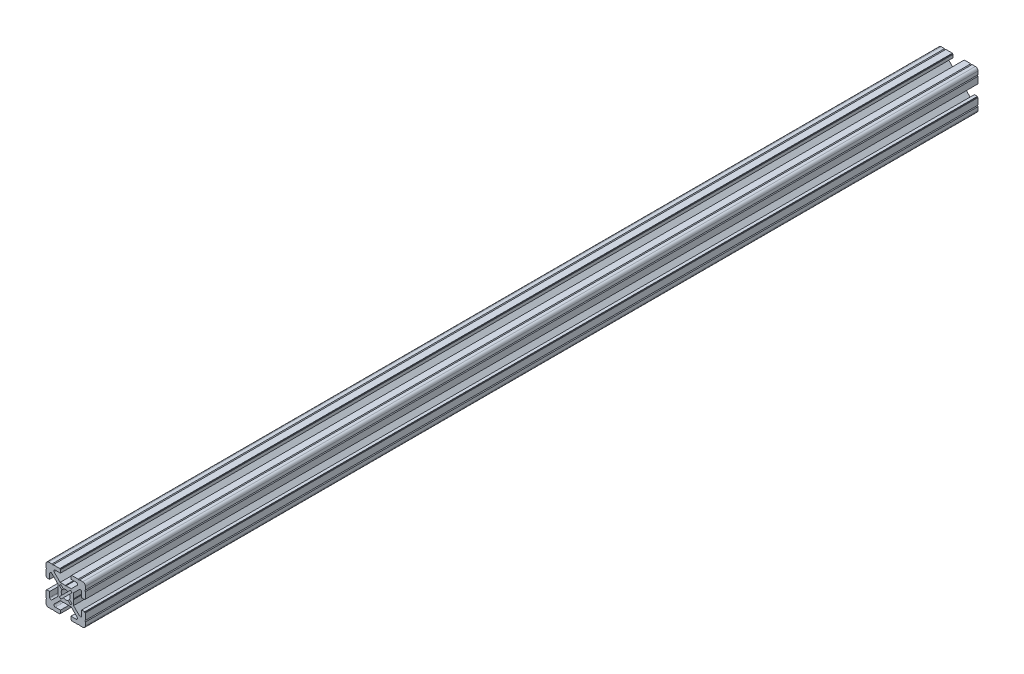
from build123d import *

# Parameters (mm, degrees)
BOSS_EXTRUDE1_DEPTH = 680


with BuildPart() as part:
    # Sketch1 → Boss-Extrude1 (new body)
    with BuildSketch(Plane.XY):
        with BuildLine():
            Line((12.999999999, 14.999999999), (10.499999999, 14.999999999))
            Line((10.499999999, 14.999999999), (9.999999999, 14.499999999))
            Line((9.999999999, 14.499999999), (9.5, 14.999999999))
            Line((9.5, 14.999999999), (4.5, 14.999999999))
            Line((4.5, 14.999999999), (4.5, 14.5))
            Line((4.5, 14.5), (4, 14.5))
            Line((4, 14.5), (4, 12.200000005))
            Line((4, 12.200000005), (7.999999994, 12.200000005))
            ThreePointArc((7.999999994, 12.200000005), (8.923879532, 11.582683434), (8.707106779, 10.492893215))
            Line((8.707106779, 10.492893215), (4.214213564, 6))
            Line((4.214213564, 6), (0.312520901, 6))
            Line((0.312520901, 6), (0, 5.7))
            Line((0, 5.7), (-0.312520903, 6))
            Line((-0.312520903, 6), (-4.214213564, 6))
            Line((-4.214213564, 6), (-8.70710678, 10.492893215))
            ThreePointArc((-8.70710678, 10.492893215), (-8.923879532, 11.582683434), (-7.999999995, 12.200000005))
            Line((-7.999999995, 12.200000005), (-4, 12.200000005))
            Line((-4, 12.200000005), (-4, 14.5))
            Line((-4, 14.5), (-4.5, 14.5))
            Line((-4.5, 14.5), (-4.5, 14.999999999))
            Line((-4.5, 14.999999999), (-9.500000003, 14.999999999))
            Line((-9.500000003, 14.999999999), (-10.000000002, 14.499999999))
            Line((-10.000000002, 14.499999999), (-10.500000001, 14.999999999))
            Line((-10.500000001, 14.999999999), (-13, 14.999999999))
            ThreePointArc((-13, 14.999999999), (-14.414213562, 14.414213561), (-15, 12.999999999))
            Line((-15, 12.999999999), (-15, 10.5))
            Line((-15, 10.5), (-14.500000001, 10.000000001))
            Line((-14.500000001, 10.000000001), (-15, 9.500000001))
            Line((-15, 9.500000001), (-15, 4.5))
            Line((-15, 4.5), (-14.5, 4.5))
            Line((-14.5, 4.5), (-14.5, 4))
            Line((-14.5, 4), (-12.200000005, 4))
            Line((-12.200000005, 4), (-12.200000005, 7.999999994))
            ThreePointArc((-12.200000005, 7.999999994), (-11.582683434, 8.923879532), (-10.492893215, 8.707106779))
            Line((-10.492893215, 8.707106779), (-6, 4.214213564))
            Line((-6, 4.214213564), (-6, 0.312520901))
            Line((-6, 0.312520901), (-5.7, 0))
            Line((-5.7, 0), (-6, -0.312520903))
            Line((-6, -0.312520903), (-6, -4.214213564))
            Line((-6, -4.214213564), (-10.492893215, -8.70710678))
            ThreePointArc((-10.492893215, -8.70710678), (-11.582683434, -8.923879532), (-12.200000005, -7.999999995))
            Line((-12.200000005, -7.999999995), (-12.200000005, -4))
            Line((-12.200000005, -4), (-14.5, -4))
            Line((-14.5, -4), (-14.5, -4.5))
            Line((-14.5, -4.5), (-15, -4.5))
            Line((-15, -4.5), (-15, -9.500000001))
            Line((-15, -9.500000001), (-14.500000001, -10.000000001))
            Line((-14.500000001, -10.000000001), (-15, -10.5))
            Line((-15, -10.5), (-15, -13))
            ThreePointArc((-15, -13), (-14.414213562, -14.414213562), (-13, -15))
            Line((-13, -15), (-10.489897949, -15))
            Line((-10.489897949, -15), (-9.989897949, -14.5))
            Line((-9.989897949, -14.5), (-9.500000001, -15))
            Line((-9.500000001, -15), (-4.5, -15))
            Line((-4.5, -15), (-4.5, -14.5))
            Line((-4.5, -14.5), (-4, -14.5))
            Line((-4, -14.5), (-4, -12.200000005))
            Line((-4, -12.200000005), (-7.999999995, -12.200000005))
            ThreePointArc((-7.999999995, -12.200000005), (-8.923879532, -11.582683434), (-8.70710678, -10.492893215))
            Line((-8.70710678, -10.492893215), (-4.214213564, -6))
            Line((-4.214213564, -6), (-0.312520901, -6))
            Line((-0.312520901, -6), (0, -5.7))
            Line((0, -5.7), (0.312520903, -6))
            Line((0.312520903, -6), (4.214213564, -6))
            Line((4.214213564, -6), (8.70710678, -10.492893215))
            ThreePointArc((8.70710678, -10.492893215), (8.923879532, -11.582683434), (7.999999995, -12.200000005))
            Line((7.999999995, -12.200000005), (4, -12.200000005))
            Line((4, -12.200000005), (4, -14.5))
            Line((4, -14.5), (4.5, -14.5))
            Line((4.5, -14.5), (4.5, -15))
            Line((4.5, -15), (9.500000001, -15))
            Line((9.500000001, -15), (10.000000001, -14.500000001))
            Line((10.000000001, -14.500000001), (10.5, -15))
            Line((10.5, -15), (12.999999999, -15))
            ThreePointArc((12.999999999, -15), (14.414213561, -14.414213562), (14.999999999, -13))
            Line((14.999999999, -13), (14.999999999, -10.500000001))
            Line((14.999999999, -10.500000001), (14.499999999, -10.000000002))
            Line((14.499999999, -10.000000002), (14.999999999, -9.500000002))
            Line((14.999999999, -9.500000002), (14.999999999, -4.5))
            Line((14.999999999, -4.5), (14.5, -4.5))
            Line((14.5, -4.5), (14.5, -4))
            Line((14.5, -4), (12.200000005, -4))
            Line((12.200000005, -4), (12.200000005, -7.999999995))
            ThreePointArc((12.200000005, -7.999999995), (11.582683434, -8.923879532), (10.492893215, -8.70710678))
            Line((10.492893215, -8.70710678), (6, -4.214213564))
            Line((6, -4.214213564), (6, -0.312520901))
            Line((6, -0.312520901), (5.7, 0))
            Line((5.7, 0), (6, 0.312520903))
            Line((6, 0.312520903), (6, 4.214213564))
            Line((6, 4.214213564), (10.492893215, 8.70710678))
            ThreePointArc((10.492893215, 8.70710678), (11.582683434, 8.923879532), (12.200000005, 7.999999995))
            Line((12.200000005, 7.999999995), (12.200000005, 4))
            Line((12.200000005, 4), (14.5, 4))
            Line((14.5, 4), (14.5, 4.5))
            Line((14.5, 4.5), (14.999999999, 4.5))
            Line((14.999999999, 4.5), (14.999999999, 9.5))
            Line((14.999999999, 9.5), (14.499999999, 9.999999999))
            Line((14.499999999, 9.999999999), (14.999999999, 10.499999999))
            Line((14.999999999, 10.499999999), (14.999999999, 12.999999999))
            ThreePointArc((14.999999999, 12.999999999), (14.414213561, 14.414213561), (12.999999999, 14.999999999))
        make_face()
        with BuildLine():
            Line((-2.902349714, 1.770978864), (-4.808326112, 3.676955262))
            Line((-4.808326112, 3.676955262), (-3.676955262, 4.808326112))
            Line((-3.676955262, 4.808326112), (-1.770978864, 2.902349714))
            ThreePointArc((-1.770978864, 2.902349714), (0, 3.4), (1.770978864, 2.902349714))
            Line((1.770978864, 2.902349714), (3.676955262, 4.808326112))
            Line((3.676955262, 4.808326112), (4.808326112, 3.676955262))
            Line((4.808326112, 3.676955262), (2.902349714, 1.770978864))
            ThreePointArc((2.902349714, 1.770978864), (3.4, 0), (2.902349714, -1.770978864))
            Line((2.902349714, -1.770978864), (4.808326112, -3.676955262))
            Line((4.808326112, -3.676955262), (3.676955262, -4.808326112))
            Line((3.676955262, -4.808326112), (1.770978864, -2.902349714))
            ThreePointArc((1.770978864, -2.902349714), (0, -3.4), (-1.770978864, -2.902349714))
            Line((-1.770978864, -2.902349714), (-3.676955262, -4.808326112))
            Line((-3.676955262, -4.808326112), (-4.808326112, -3.676955262))
            Line((-4.808326112, -3.676955262), (-2.902349714, -1.770978864))
            ThreePointArc((-2.902349714, -1.770978864), (-3.4, 0), (-2.902349714, 1.770978864))
        make_face(mode=Mode.SUBTRACT)
    extrude(amount=BOSS_EXTRUDE1_DEPTH)


solid = part.part
